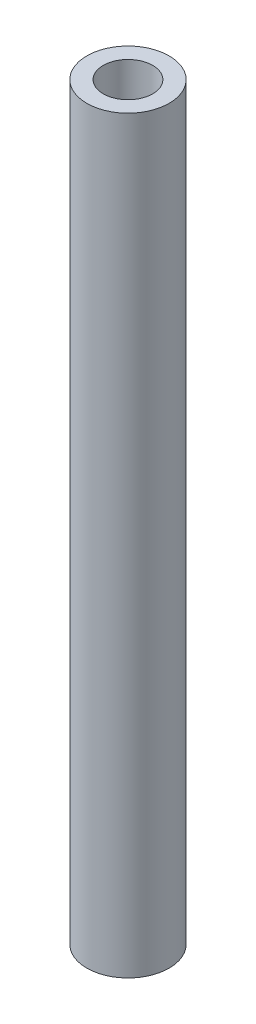
from build123d import *

# Parameters (mm, degrees)
SKETCH_1_R      = 2.5
SKETCH_1_R_2    = 1.5
EXTRUDE_1_DEPTH = 45.5


with BuildPart() as part:
    # 草图1 → 凸台-拉伸1 (new body)
    with BuildSketch(Plane(origin=(0, 0, 0), x_dir=(1, 0, 0), z_dir=(0, 1, 0))):
        with Locations(Location((0, 0, 0), (0, 0, 270))):
            Circle(SKETCH_1_R)
        with Locations(Location((0, 0, 0), (0, 0, 270))):
            Circle(SKETCH_1_R_2, mode=Mode.SUBTRACT)
    extrude(amount=EXTRUDE_1_DEPTH)


solid = part.part
